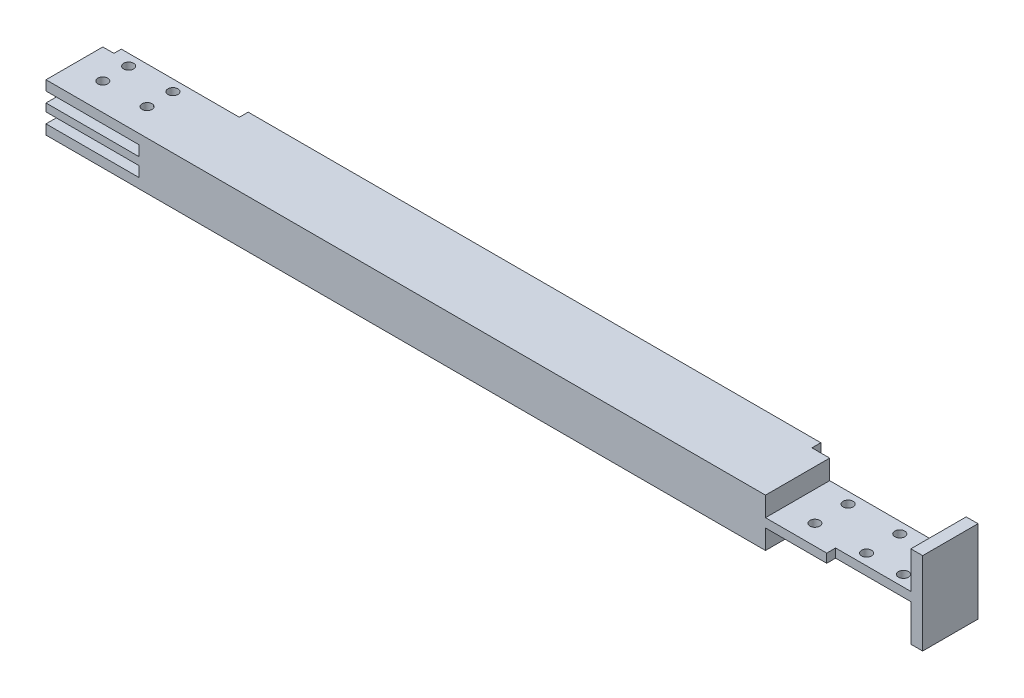
from build123d import *

# Parameters (mm, degrees)
SKETCH1_W                  = 1176
SKETCH1_H                  = 75
BOSS_EXTRUDE1_DEPTH        = 65
SKETCH2_W                  = 776
SKETCH2_H                  = 65
BOSS_EXTRUDE2_DEPTH        = 12
SKETCH3_W                  = 1058
SKETCH3_H                  = 65
BOSS_EXTRUDE3_DEPTH        = 12
SKETCH4_W                  = 16
SKETCH4_H                  = 23.5
SKETCH4_H_2                = 65
BOSS_EXTRUDE4_DEPTH        = 75
CUT_EXTRUDE1_DEPTH         = 601.953617179
CUT_EXTRUDE1_DEPTH_BACK    = 601.953617179
SKETCH5_W                  = 102
SKETCH5_H                  = 50
F_12_0MM_DOWEL_HOLE1_D     = 13.5
F_12_0MM_DOWEL_HOLE1_DEPTH = 65
CUT_EXTRUDE2_DEPTH         = 10
CUT_EXTRUDE3_DEPTH         = 601.953617179
CUT_EXTRUDE3_DEPTH_BACK    = 601.953617179
SKETCH11_W                 = 127.490852802
SKETCH11_H                 = 14
CUT_EXTRUDE4_DEPTH         = 601.953617179
CUT_EXTRUDE4_DEPTH_BACK    = 601.953617179
SKETCH12_W                 = 83
SKETCH12_H                 = 26.5


with BuildPart() as part:
    # Sketch1 → Boss-Extrude1 (new body)
    with BuildSketch(Plane(origin=(0, 0, 0), x_dir=(1, 0, 0), z_dir=(0, 1, 0))):
        Rectangle(SKETCH1_W, SKETCH1_H)
    extrude(amount=BOSS_EXTRUDE1_DEPTH)

    # Sketch2 → Boss-Extrude2 (add)
    with BuildSketch(Plane.XY.offset(-37.5)):
        with Locations((-25, 32.5)):
            Rectangle(SKETCH2_W, SKETCH2_H)
    extrude(amount=-BOSS_EXTRUDE2_DEPTH)

    # Sketch3 → Boss-Extrude3 (add)
    with BuildSketch(Plane.XY.offset(37.5)):
        with Locations((-59, 32.5)):
            Rectangle(SKETCH3_W, SKETCH3_H)
    extrude(amount=BOSS_EXTRUDE3_DEPTH)

    # Sketch4 → Boss-Extrude4 (add)
    with BuildSketch(Plane.XY.offset(37.5)):
        with Locations((580, -11.75)):
            Rectangle(SKETCH4_W, SKETCH4_H)
        with Locations((580, 32.5)):
            Rectangle(SKETCH4_W, SKETCH4_H_2)
        with Locations((580, 76.75)):
            Rectangle(SKETCH4_W, SKETCH4_H)
    extrude(amount=-BOSS_EXTRUDE4_DEPTH)

    # Sketch5 → Cut-Extrude1 (cut, two sides: drawn at the far end of the back side and taken through both)
    with BuildSketch(Plane.XY.offset(37.5).offset(-CUT_EXTRUDE1_DEPTH_BACK)):
        with Locations((521, 1.5)):
            Rectangle(SKETCH5_W, SKETCH5_H)
        with Locations((521, 63.5)):
            Rectangle(SKETCH5_W, SKETCH5_H)
    extrude(amount=CUT_EXTRUDE1_DEPTH + CUT_EXTRUDE1_DEPTH_BACK, mode=Mode.SUBTRACT)

    # Ø12.0mm Dowel Hole1
    with Locations(Plane(origin=(0, 65, 0), x_dir=(1, 0, 0), z_dir=(0, 1, 0))):
        with Locations((-548, -12.5), (-488, -12.5), (-488, 22.5), (-548, 22.5), (427, 22.5), (497, 22.5), (547, 22.5), (547, -22.5), (497, -22.5), (427, -22.5)):
            Hole(F_12_0MM_DOWEL_HOLE1_D / 2, depth=F_12_0MM_DOWEL_HOLE1_DEPTH)

    # Sketch9 → Cut-Extrude2 (cut)
    with BuildSketch(Plane(origin=(0, 0, -37.5), x_dir=(-1, 0, 0), z_dir=(0, 0, -1))):
        with BuildLine():
            Line((462, 51.75), (462, 37.75))
            Line((462, 37.75), (600.472295571, 37.75))
            ThreePointArc((600.472295571, 37.75), (600.253164472, 32.5), (600.472295571, 27.25))
            Line((600.472295571, 27.25), (462, 27.25))
            Line((462, 27.25), (462, 13.25))
            Line((462, 13.25), (569.202978401, 13.25))
            ThreePointArc((569.202978401, 13.25), (759.253164472, 32.5), (569.202978401, 51.75))
            Line((569.202978401, 51.75), (462, 51.75))
        make_face()
    extrude(amount=-CUT_EXTRUDE2_DEPTH, mode=Mode.SUBTRACT)

    # Sketch11 → Cut-Extrude3 (cut, two sides: drawn at the far end of the back side and taken through both)
    with BuildSketch(Plane(origin=(0, 0, -37.5), x_dir=(-1, 0, 0), z_dir=(0, 0, -1)).offset(-CUT_EXTRUDE3_DEPTH_BACK)):
        with Locations((525.745426401, 44.75)):
            Rectangle(SKETCH11_W, SKETCH11_H)
        with Locations((525.745426401, 20.25)):
            Rectangle(SKETCH11_W, SKETCH11_H)
    extrude(amount=CUT_EXTRUDE3_DEPTH + CUT_EXTRUDE3_DEPTH_BACK, mode=Mode.SUBTRACT)

    # Sketch12 → Cut-Extrude4 (cut, two sides: drawn at the far end of the back side and taken through both)
    with BuildSketch(Plane(origin=(0, 0, -37.5), x_dir=(-1, 0, 0), z_dir=(0, 0, -1)).offset(-CUT_EXTRUDE4_DEPTH_BACK)):
        with Locations((-428.5, 13.25)):
            Rectangle(SKETCH12_W, SKETCH12_H)
        with Locations((-428.5, 51.75)):
            Rectangle(SKETCH12_W, SKETCH12_H)
    extrude(amount=CUT_EXTRUDE4_DEPTH + CUT_EXTRUDE4_DEPTH_BACK, mode=Mode.SUBTRACT)


solid = part.part
